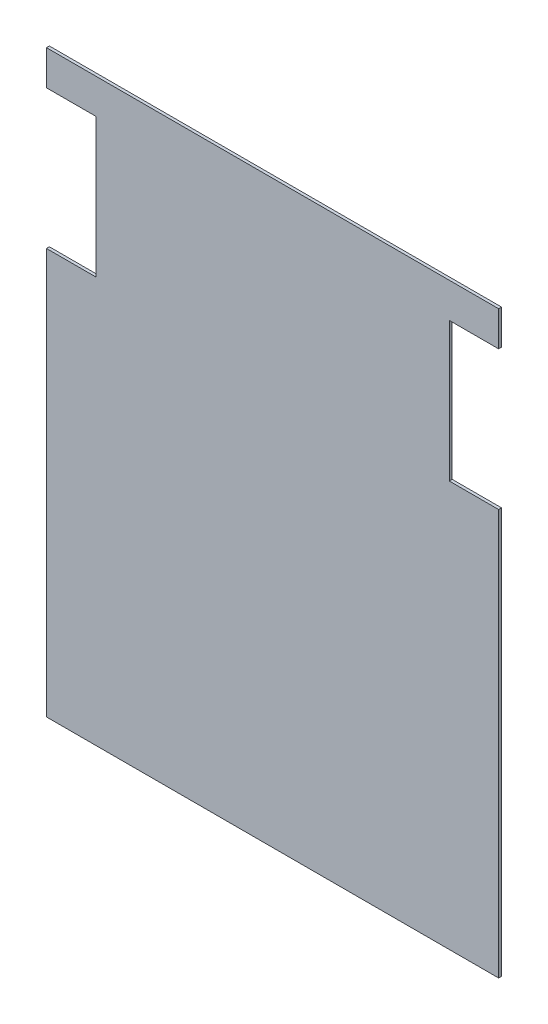
from build123d import *

# Parameters (mm, degrees)
BOSS_EXTRUDE1_DEPTH = 3.175


with BuildPart() as part:
    # Sketch1 → Boss-Extrude1 (new body)
    with BuildSketch(Plane.XY):
        Polygon((-247.65, 127), (-247.65, -317.5), (247.65, -317.5), (247.65, 127), (193.675, 127), (193.675, 279.4), (247.65, 279.4), (247.65, 317.5), (-247.65, 317.5), (-247.65, 279.4), (-193.675, 279.4), (-193.675, 127), align=None)
    extrude(amount=BOSS_EXTRUDE1_DEPTH)


solid = part.part
